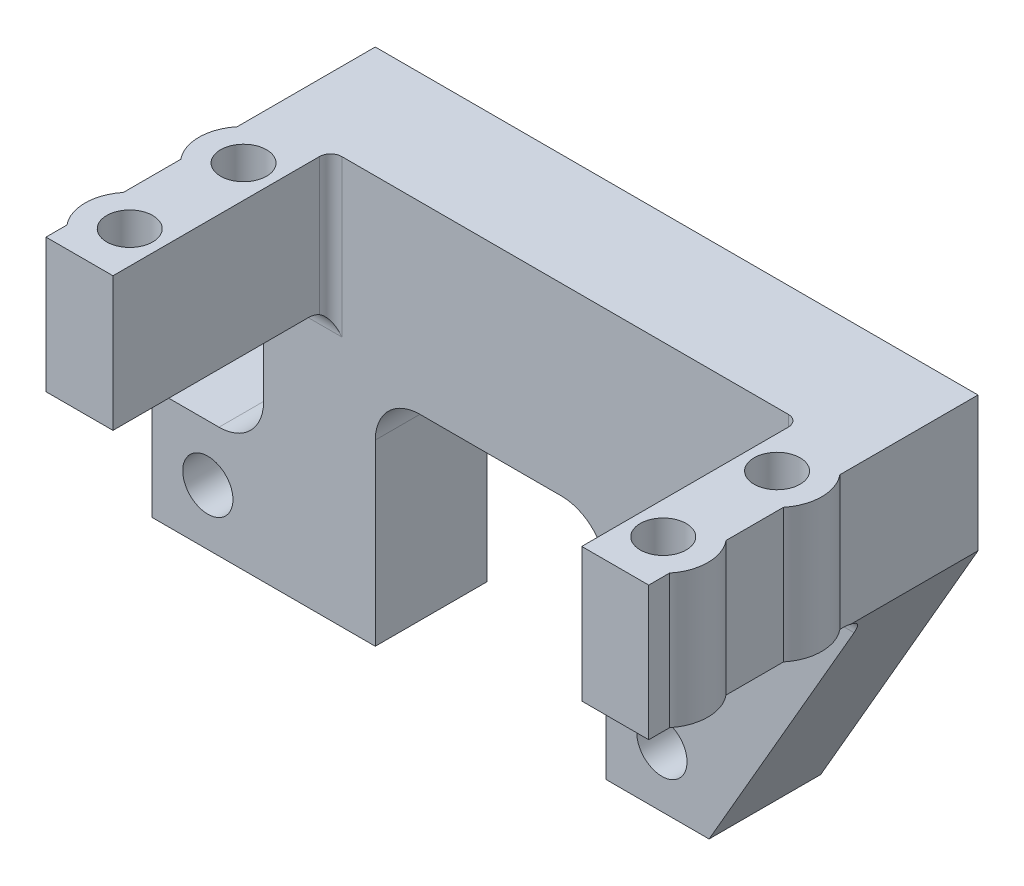
from build123d import *

# Parameters (mm, degrees)
SKETCH1_W            = 54
SKETCH1_H            = 26.5
BOSS_EXTRUDE1_DEPTH  = 10
CUT_EXTRUDE1_DEPTH   = 10
SKETCH3_W            = 15
SKETCH3_H            = 10
SKETCH3_W_2          = 10
BOSS_EXTRUDE2_DEPTH  = 10
CUT_EXTRUDE2_DEPTH   = 10
SKETCH5_W            = 20.679801083
SKETCH5_H            = 5
CUT_EXTRUDE3_DEPTH   = 10
SKETCH6_W            = 6
SKETCH6_H            = 12
BOSS_EXTRUDE3_DEPTH  = 19.5
SKETCH7_R            = 2.06
CUT_EXTRUDE4_DEPTH   = 55.143328306
SKETCH8_R            = 2.06
BOSS_EXTRUDE4_DEPTH  = 12
FILLET1_R            = 2
FILLET2_R            = 1
FILLET1_OF_MIRROR1_R = 2
FILLET2_OF_MIRROR1_R = 1
SKETCH9_R            = 2.25
CUT_EXTRUDE5_DEPTH   = 10
CUT_EXTRUDE6_DEPTH   = 10
SKETCH11_W           = 20.679801083
SKETCH11_H           = 10
CUT_EXTRUDE7_DEPTH   = 10
FILLET3_R            = 4
SKETCH12_W           = 10
SKETCH12_H           = 10
BOSS_EXTRUDE5_DEPTH  = 10
SKETCH13_R           = 2.25
CUT_EXTRUDE8_DEPTH   = 10
FILLET4_R            = 4


with BuildPart() as part:
    # Sketch1 → Boss-Extrude1 (new body)
    with BuildSketch(Plane.XY):
        Rectangle(SKETCH1_W, SKETCH1_H)
    boss_extrude1 = extrude(amount=BOSS_EXTRUDE1_DEPTH)

    # Sketch2 → Cut-Extrude1 (cut)
    with BuildSketch(Plane(origin=(0, 0, 0), x_dir=(-1, 0, 0), z_dir=(0, 0, -1))):
        Polygon((-27, 1.161007253), (-18.679801083, -13.25), (-27, -13.25), align=None)
    extrude(amount=-CUT_EXTRUDE1_DEPTH, mode=Mode.SUBTRACT)

    # Sketch3 → Boss-Extrude2 (add)
    with BuildSketch(Plane.XZ.offset(13.25)):
        with Locations((11.179801083, 5)):
            Rectangle(SKETCH3_W, SKETCH3_H)
        with Locations((-22, 5)):
            Rectangle(SKETCH3_W_2, SKETCH3_H)
    extrude(amount=BOSS_EXTRUDE2_DEPTH)

    # Sketch4 → Cut-Extrude2 (cut)
    with BuildSketch(Plane(origin=(0, 0, 0), x_dir=(-1, 0, 0), z_dir=(0, 0, -1))):
        Polygon((-18.679801083, -13.25), (-12.906298391, -23.25), (-18.679801083, -23.25), align=None)
    extrude(amount=-CUT_EXTRUDE2_DEPTH, mode=Mode.SUBTRACT)

    # Sketch5 → Cut-Extrude3 (cut)
    with BuildSketch(Plane(origin=(0, 0, 0), x_dir=(-1, 0, 0), z_dir=(0, 0, -1))):
        with Locations((6.660099458, -10.75)):
            Rectangle(SKETCH5_W, SKETCH5_H)
    extrude(amount=-CUT_EXTRUDE3_DEPTH, mode=Mode.SUBTRACT)

    # Sketch6 → Boss-Extrude3 (add)
    with BuildSketch(Plane.XY.offset(10)):
        with Locations((24, 7.25)):
            Rectangle(SKETCH6_W, SKETCH6_H)
    boss_extrude3 = extrude(amount=BOSS_EXTRUDE3_DEPTH)

    # Sketch7 → Cut-Extrude4 (cut, through all)
    with BuildSketch(Plane(origin=(0, 13.25, 0), x_dir=(1, 0, 0), z_dir=(0, 1, 0))):
        with Locations(Location((23.9, -25.1, 0), (0, 0, 270))):
            Circle(SKETCH7_R)
        with Locations(Location((23.9, -14.9, 0), (0, 0, 270))):
            Circle(SKETCH7_R)
    cut_extrude4 = extrude(amount=-CUT_EXTRUDE4_DEPTH, mode=Mode.SUBTRACT)

    # Sketch8 → Boss-Extrude4 (add)
    # profile 1 of 2: a face of its own
    with BuildSketch(Plane(origin=(0, 13.25, 0), x_dir=(1, 0, 0), z_dir=(0, 1, 0))):
        with BuildLine():
            Line((21, -27.854995463), (21, -22.345004537))
            ThreePointArc((21, -22.345004537), (27.9, -25.1), (21, -27.854995463))
        make_face()
        with Locations(Location((23.9, -25.1, 0), (0, 0, 270))):
            Circle(SKETCH8_R, mode=Mode.SUBTRACT)
    # profile 2 of 2: a face of its own
    with BuildSketch(Plane(origin=(0, 13.25, 0), x_dir=(1, 0, 0), z_dir=(0, 1, 0))):
        with BuildLine():
            Line((21, -17.654995463), (21, -12.145004537))
            ThreePointArc((21, -12.145004537), (27.9, -14.9), (21, -17.654995463))
        make_face()
        with Locations(Location((23.9, -14.9, 0), (0, 0, 270))):
            Circle(SKETCH8_R, mode=Mode.SUBTRACT)
    boss_extrude4 = extrude(amount=-BOSS_EXTRUDE4_DEPTH)

    # Fillet1
    fillet1_edges = [part.edges().sort_by_distance(p)[0] for p in [
        (24, 1.25, 10),
    ]]
    fillet(fillet1_edges, radius=FILLET1_R)

    # Fillet2
    fillet2_edges = [part.edges().sort_by_distance(p)[0] for p in [
        (21, 6.25, 10),
    ]]
    fillet(fillet2_edges, radius=FILLET2_R)

    # Mirror1: Boss-Extrude1, Boss-Extrude3, Cut-Extrude4, Boss-Extrude4 across plane
    add(boss_extrude1.mirror(Plane(origin=(0, 0, 0), x_dir=(0, 0, 1), z_dir=(1, 0, 0))))
    add(boss_extrude3.mirror(Plane(origin=(0, 0, 0), x_dir=(0, 0, 1), z_dir=(1, 0, 0))))
    add(cut_extrude4.mirror(Plane(origin=(0, 0, 0), x_dir=(0, 0, 1), z_dir=(1, 0, 0))), mode=Mode.SUBTRACT)
    add(boss_extrude4.mirror(Plane(origin=(0, 0, 0), x_dir=(0, 0, 1), z_dir=(1, 0, 0))))

    # Fillet1 of Mirror1
    fillet1_of_mirror1_edges = [part.edges().sort_by_distance(p)[0] for p in [
        (-24, 1.25, 10),
    ]]
    fillet(fillet1_of_mirror1_edges, radius=FILLET1_OF_MIRROR1_R)

    # Fillet2 of Mirror1
    fillet2_of_mirror1_edges = [part.edges().sort_by_distance(p)[0] for p in [
        (-21, 6.25, 10),
    ]]
    fillet(fillet2_of_mirror1_edges, radius=FILLET2_OF_MIRROR1_R)

    # Sketch9 → Cut-Extrude5 (cut)
    with BuildSketch(Plane.XY.offset(10)):
        with Locations((8.679801083, -18.25)):
            Circle(SKETCH9_R)
    extrude(amount=-CUT_EXTRUDE5_DEPTH, mode=Mode.SUBTRACT)

    # Sketch10 → Cut-Extrude6 (cut)
    with BuildSketch(Plane(origin=(0, 0, 0), x_dir=(-1, 0, 0), z_dir=(0, 0, -1))):
        Polygon((-27, 1.161007253), (-18.679801083, -13.25), (-27, -13.25), align=None)
    extrude(amount=-CUT_EXTRUDE6_DEPTH, mode=Mode.SUBTRACT)

    # Sketch11 → Cut-Extrude7 (cut)
    with BuildSketch(Plane(origin=(0, 0, 0), x_dir=(-1, 0, 0), z_dir=(0, 0, -1))):
        with Locations((6.660099458, -8.25)):
            Rectangle(SKETCH11_W, SKETCH11_H)
    extrude(amount=-CUT_EXTRUDE7_DEPTH, mode=Mode.SUBTRACT)

    # Fillet3
    fillet3_edges = [part.edges().sort_by_distance(p)[0] for p in [
        (-17, -3.25, 5),
        (3.679801083, -3.25, 5),
    ]]
    fillet(fillet3_edges, radius=FILLET3_R)

    # Sketch12 → Boss-Extrude5 (add)
    with BuildSketch(Plane.XY.offset(10)):
        with Locations((-32, -18.25)):
            Rectangle(SKETCH12_W, SKETCH12_H)
    extrude(amount=-BOSS_EXTRUDE5_DEPTH)

    # Sketch13 → Cut-Extrude8 (cut)
    with BuildSketch(Plane.XY.offset(10)):
        with Locations((-32, -18.25)):
            Circle(SKETCH13_R)
    extrude(amount=-CUT_EXTRUDE8_DEPTH, mode=Mode.SUBTRACT)

    # Fillet4
    fillet4_edges = [part.edges().sort_by_distance(p)[0] for p in [
        (-27, -13.25, 5),
    ]]
    fillet(fillet4_edges, radius=FILLET4_R)


solid = part.part
